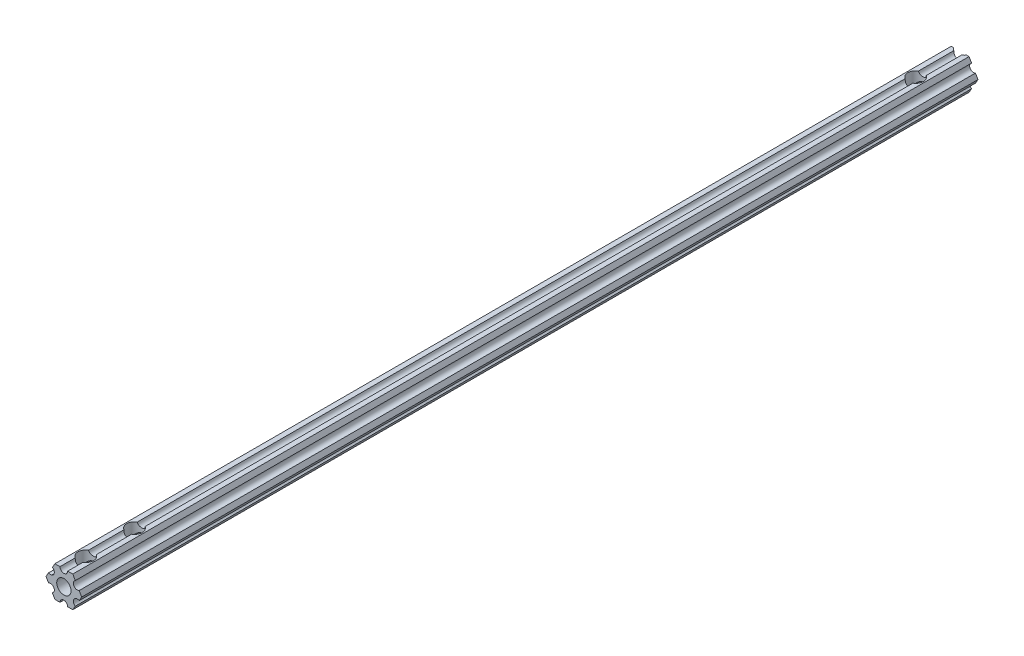
from build123d import *

# Parameters (mm, degrees)
SALIENTE_EXTRUIR1_DEPTH = 368
CROQUIS2_R              = 3.175
CORTAR_EXTRUIR1_DEPTH   = 724.745819727


with BuildPart() as part:
    # Croquis1 → Saliente-Extruir1 (new body)
    with BuildSketch(Plane.XY):
        with BuildLine():
            Line((620.448376311, 354.810426019), (619.409039206, 356.610610691))
            Line((619.409039206, 356.610610691), (617.330364997, 356.610610691))
            ThreePointArc((617.330364997, 356.610610691), (616.536614955, 355.235795338), (614.949114914, 355.23579541))
            ThreePointArc((614.949114914, 355.23579541), (614.368049644, 355.816860732), (614.155364997, 356.610610691))
            Line((614.155364997, 356.610610691), (612.076690788, 356.610610691))
            Line((612.076690788, 356.610610691), (611.037353683, 354.810426019))
            ThreePointArc((611.037353683, 354.810426019), (611.618419011, 352.641860691), (609.449853683, 352.060795362))
            Line((609.449853683, 352.060795362), (608.410516578, 350.260610691))
            Line((608.410516578, 350.260610691), (609.449853683, 348.460426019))
            ThreePointArc((609.449853683, 348.460426019), (611.618419011, 347.879360691), (611.037353683, 345.710795362))
            Line((611.037353683, 345.710795362), (612.076690788, 343.910610691))
            Line((612.076690788, 343.910610691), (614.155364997, 343.910610691))
            ThreePointArc((614.155364997, 343.910610691), (615.742864997, 345.498110691), (617.330364997, 343.910610691))
            Line((617.330364997, 343.910610691), (619.409039206, 343.910610691))
            Line((619.409039206, 343.910610691), (620.448376311, 345.710795362))
            ThreePointArc((620.448376311, 345.710795362), (619.867310982, 347.879360691), (622.035876311, 348.460426019))
            Line((622.035876311, 348.460426019), (623.075213416, 350.260610691))
            Line((623.075213416, 350.260610691), (622.035876311, 352.060795362))
            ThreePointArc((622.035876311, 352.060795362), (621.242126263, 351.848110691), (620.448376228, 352.06079541))
            ThreePointArc((620.448376228, 352.06079541), (619.654626311, 353.435610739), (620.448376311, 354.810426019))
        make_face()
        with BuildLine():
            ThreePointArc((614.276014843, 347.719952052), (618.283523635, 348.793760537), (617.209715151, 352.801269329))
            ThreePointArc((617.209715151, 352.801269329), (613.202206359, 351.727460845), (614.276014843, 347.719952052))
        make_face(mode=Mode.SUBTRACT)
    extrude(amount=-SALIENTE_EXTRUIR1_DEPTH)

    # Croquis2 → Cortar-Extruir1 (cut, through all)
    with BuildSketch(Plane(origin=(0, 356.610610691, 0), x_dir=(1, 0, 0), z_dir=(0, 1, 0))):
        with Locations(Location((615.742864997, 349.749940696, 0), (0, 0, 240))):
            Circle(CROQUIS2_R)
        with Locations((615.742864997, 369.749940696)):
            Circle(CROQUIS2_R)
        with Locations(Location((615.742864997, 29, 0), (0, 0, 240))):
            Circle(CROQUIS2_R)
        with Locations(Location((615.742864997, 9, 0), (0, 0, 240))):
            Circle(CROQUIS2_R)
    extrude(amount=-CORTAR_EXTRUIR1_DEPTH, mode=Mode.SUBTRACT)


solid = part.part
